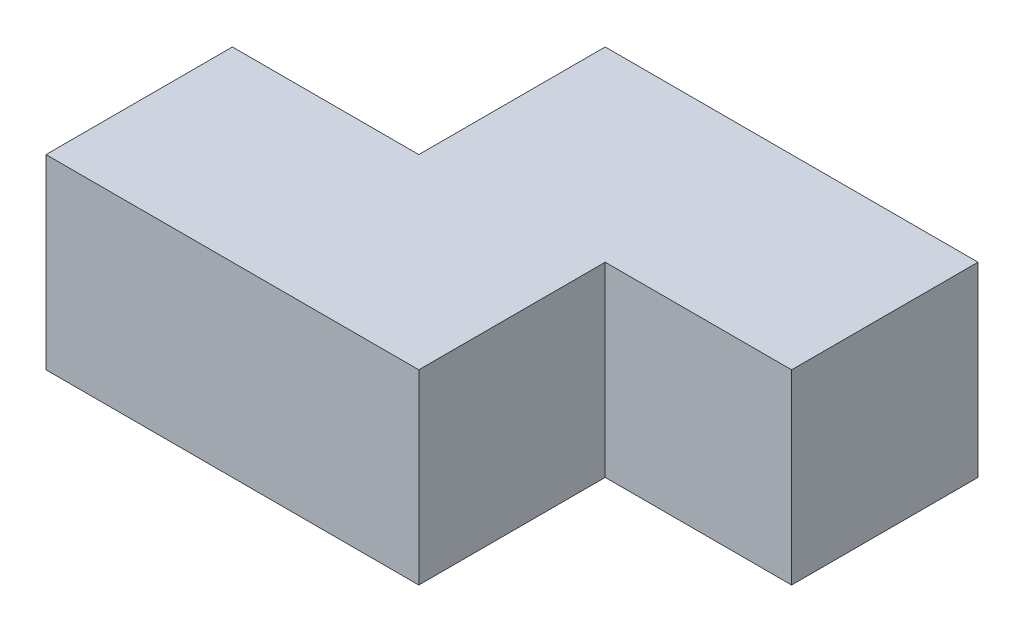
from build123d import *

# Parameters (mm, degrees)
BOSS_EXTRUDE1_DEPTH = 30


with BuildPart() as part:
    # Sketch1 → Boss-Extrude1 (new body)
    with BuildSketch(Plane(origin=(0, 0, 0), x_dir=(1, 0, 0), z_dir=(0, 1, 0))):
        Polygon((0, 0), (0, 30), (30, 30), (30, 60), (90, 60), (90, 30), (60, 30), (60, 0), align=None)
    extrude(amount=BOSS_EXTRUDE1_DEPTH)


solid = part.part
